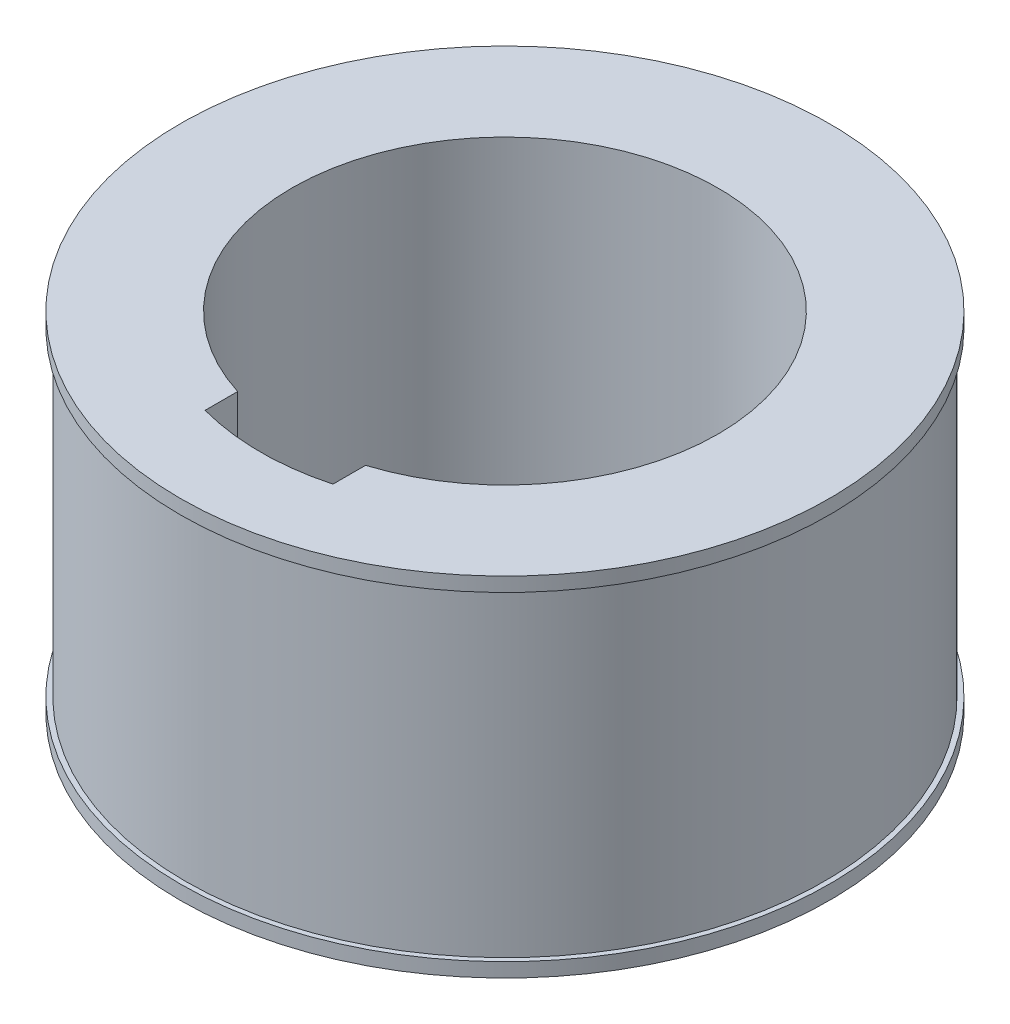
from build123d import *

# Parameters (mm, degrees)
SKETCH1_R           = 45
BOSS_EXTRUDE1_DEPTH = 22.5
SKETCH2_R           = 45.69
BOSS_EXTRUDE2_DEPTH = 2
SKETCH3_R           = 40
SKETCH3_R_2         = 38
CUT_EXTRUDE1_DEPTH  = 32
SKETCH4_R           = 30
CUT_EXTRUDE2_DEPTH  = 82.093478159
CUT_EXTRUDE3_DEPTH  = 82.093478159


with BuildPart() as part:
    # Sketch1 → Boss-Extrude1 (new, symmetric)
    with BuildSketch(Plane(origin=(0, 0, 0), x_dir=(1, 0, 0), z_dir=(0, 1, 0))):
        with Locations(Location((0, 0, 0), (0, 0, 90))):
            Circle(SKETCH1_R)
    extrude(amount=BOSS_EXTRUDE1_DEPTH, both=True)

    # Sketch2 → Boss-Extrude2 (add)
    with BuildSketch(Plane(origin=(0, 22.5, 0), x_dir=(1, 0, 0), z_dir=(0, 1, 0))):
        with Locations(Location((0, 0, 0), (0, 0, 270))):
            Circle(SKETCH2_R)
    boss_extrude2 = extrude(amount=BOSS_EXTRUDE2_DEPTH)

    # Mirror1: Boss-Extrude2 across plane
    add(boss_extrude2.mirror(Plane.ZX))

    # Sketch3 → Cut-Extrude1 (cut)
    with BuildSketch(Plane(origin=(0, 0, 0), x_dir=(1, 0, 0), z_dir=(0, 1, 0))):
        with Locations(Location((0, 0, 0), (0, 0, 270))):
            Circle(SKETCH3_R)
        with Locations(Location((0, 0, 0), (0, 0, 270))):
            Circle(SKETCH3_R_2, mode=Mode.SUBTRACT)
    extrude(amount=-CUT_EXTRUDE1_DEPTH, mode=Mode.SUBTRACT)

    # Sketch4 → Cut-Extrude2 (cut, through all)
    with BuildSketch(Plane.XZ.offset(24.5)):
        with Locations(Location((0, 0, 0), (0, 0, 270))):
            Circle(SKETCH4_R)
    extrude(amount=-CUT_EXTRUDE2_DEPTH, mode=Mode.SUBTRACT)

    # Sketch6 → Cut-Extrude3 (cut, through all)
    with BuildSketch(Plane.XZ.offset(24.5)):
        with BuildLine():
            Line((-9, 28.618176043), (-9, 33.20180718))
            ThreePointArc((-9, 33.20180718), (0, 34.4), (9, 33.20180718))
            Line((9, 33.20180718), (9, 28.618176043))
            ThreePointArc((9, 28.618176043), (0, 30), (-9, 28.618176043))
        make_face()
    extrude(amount=-CUT_EXTRUDE3_DEPTH, mode=Mode.SUBTRACT)


solid = part.part
